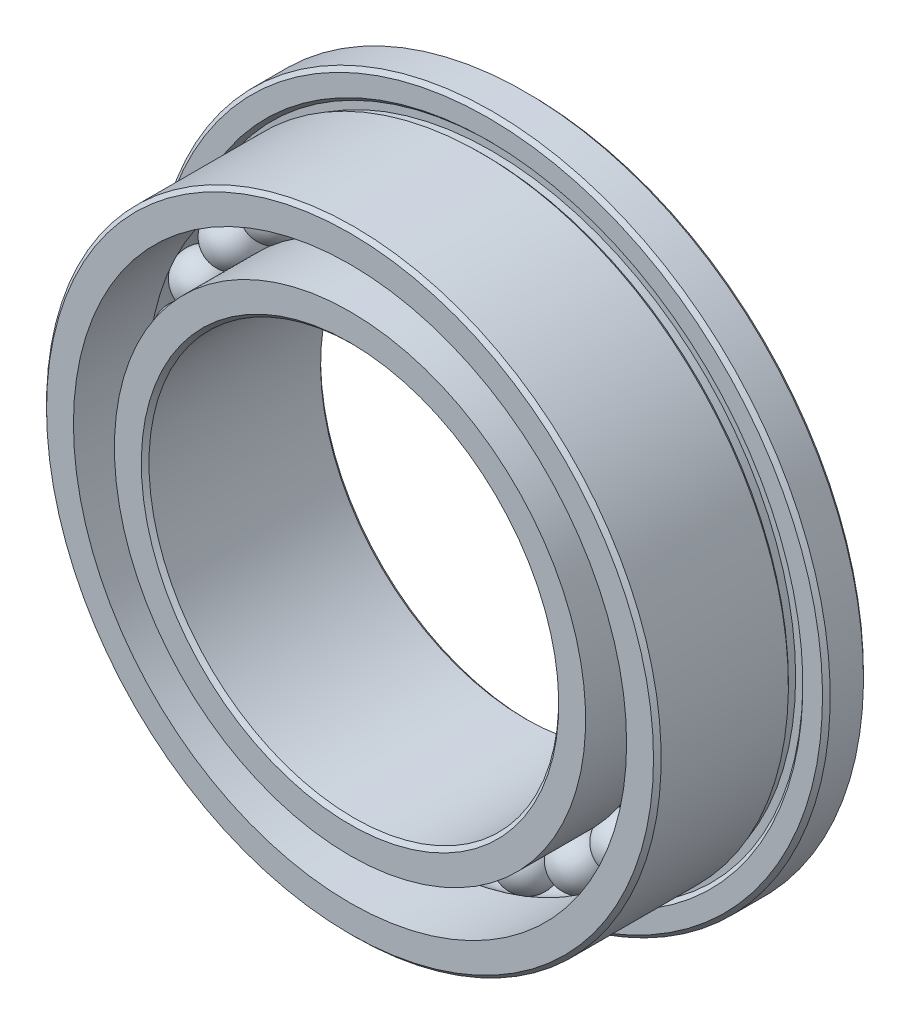
from build123d import *

# Parameters (mm, degrees)
FILLET1_SIZE      = 0.075
FILLET2_SIZE      = 0.075
CIRPATTERN3_COUNT = 27


with BuildPart() as part:
    # Sketch2 → Revolve1 (revolve)
    with BuildSketch(Plane(origin=(0, 0, 0), x_dir=(0, 0, -1), z_dir=(1, 0, 0)), mode=Mode.PRIVATE) as revolve1_sk:
        with BuildLine():
            Line((1.75, 6.6), (0.95, 6.6))
            Line((0.95, 6.6), (0.95, 6.141421356))
            Line((0.95, 6.141421356), (1.020710678, 6.070710678))
            Line((1.020710678, 6.070710678), (1.020710678, 5.929289322))
            Line((1.020710678, 5.929289322), (0.879289322, 5.929289322))
            Line((0.879289322, 5.929289322), (0.808578644, 6))
            Line((0.808578644, 6), (-1.75, 6))
            Line((-1.75, 6), (-1.75, 5.4))
            Line((-1.75, 5.4), (-0.3, 5.4))
            ThreePointArc((-0.3, 5.4), (0, 5.5), (0.3, 5.4))
            Line((0.3, 5.4), (1.75, 5.4))
            Line((1.75, 5.4), (1.75, 6.6))
        make_face()
        with BuildLine():
            Line((1.75, 4), (-1.75, 4))
            Line((-1.75, 4), (-1.75, 4.6))
            Line((-1.75, 4.6), (-0.3, 4.6))
            ThreePointArc((-0.3, 4.6), (0, 4.5), (0.3, 4.6))
            Line((0.3, 4.6), (1.75, 4.6))
            Line((1.75, 4.6), (1.75, 4))
        make_face()
    revolve(revolve1_sk.sketch.rotate(Axis((0, 0, 0), (0, 0, -1)), 180), axis=Axis((0, 0, 0), (0, 0, -1)))

    # Fillet1
    fillet1_edges = [part.edges().sort_by_distance(p)[0] for p in [
        (0, 6, 1.75),
        (0, 6.6, -1.75),
        (0, 6.6, -0.95),
    ]]
    chamfer(fillet1_edges, length=FILLET1_SIZE)

    # Fillet2
    fillet2_edges = [part.edges().sort_by_distance(p)[0] for p in [
        (0, 4, -1.75),
        (0, 4, 1.75),
    ]]
    chamfer(fillet2_edges, length=FILLET2_SIZE)


with BuildPart() as body_2:
    # Sketch7 → Revolve3 (revolve)
    with BuildSketch(Plane.XY):
        with BuildLine():
            Line((0, 5.5), (0, 4.5))
            ThreePointArc((0, 4.5), (-0.5, 5), (0, 5.5))
        make_face()
    revolve(axis=Axis((0, 5.5, 0), (0, -1, 0)))


with BuildPart() as cirpattern3_1:
    # CirPattern3: pattern copy
    add(body_2.part.rotate(Axis((0, 0, 0), (0, 0, 1)), 1 * 360 / CIRPATTERN3_COUNT))


with BuildPart() as cirpattern3_2:
    # CirPattern3: pattern copy
    add(body_2.part.rotate(Axis((0, 0, 0), (0, 0, 1)), 2 * 360 / CIRPATTERN3_COUNT))


with BuildPart() as cirpattern3_3:
    # CirPattern3: pattern copy
    add(body_2.part.rotate(Axis((0, 0, 0), (0, 0, 1)), 3 * 360 / CIRPATTERN3_COUNT))


with BuildPart() as cirpattern3_4:
    # CirPattern3: pattern copy
    add(body_2.part.rotate(Axis((0, 0, 0), (0, 0, 1)), 4 * 360 / CIRPATTERN3_COUNT))


with BuildPart() as cirpattern3_5:
    # CirPattern3: pattern copy
    add(body_2.part.rotate(Axis((0, 0, 0), (0, 0, 1)), 5 * 360 / CIRPATTERN3_COUNT))


with BuildPart() as cirpattern3_6:
    # CirPattern3: pattern copy
    add(body_2.part.rotate(Axis((0, 0, 0), (0, 0, 1)), 6 * 360 / CIRPATTERN3_COUNT))


with BuildPart() as cirpattern3_7:
    # CirPattern3: pattern copy
    add(body_2.part.rotate(Axis((0, 0, 0), (0, 0, 1)), 7 * 360 / CIRPATTERN3_COUNT))


with BuildPart() as cirpattern3_8:
    # CirPattern3: pattern copy
    add(body_2.part.rotate(Axis((0, 0, 0), (0, 0, 1)), 8 * 360 / CIRPATTERN3_COUNT))


with BuildPart() as cirpattern3_9:
    # CirPattern3: pattern copy
    add(body_2.part.rotate(Axis((0, 0, 0), (0, 0, 1)), 9 * 360 / CIRPATTERN3_COUNT))


with BuildPart() as cirpattern3_10:
    # CirPattern3: pattern copy
    add(body_2.part.rotate(Axis((0, 0, 0), (0, 0, 1)), 10 * 360 / CIRPATTERN3_COUNT))


with BuildPart() as cirpattern3_11:
    # CirPattern3: pattern copy
    add(body_2.part.rotate(Axis((0, 0, 0), (0, 0, 1)), 11 * 360 / CIRPATTERN3_COUNT))


with BuildPart() as cirpattern3_12:
    # CirPattern3: pattern copy
    add(body_2.part.rotate(Axis((0, 0, 0), (0, 0, 1)), 12 * 360 / CIRPATTERN3_COUNT))


with BuildPart() as cirpattern3_13:
    # CirPattern3: pattern copy
    add(body_2.part.rotate(Axis((0, 0, 0), (0, 0, 1)), 13 * 360 / CIRPATTERN3_COUNT))


with BuildPart() as cirpattern3_14:
    # CirPattern3: pattern copy
    add(body_2.part.rotate(Axis((0, 0, 0), (0, 0, 1)), 14 * 360 / CIRPATTERN3_COUNT))


with BuildPart() as cirpattern3_15:
    # CirPattern3: pattern copy
    add(body_2.part.rotate(Axis((0, 0, 0), (0, 0, 1)), 15 * 360 / CIRPATTERN3_COUNT))


with BuildPart() as cirpattern3_16:
    # CirPattern3: pattern copy
    add(body_2.part.rotate(Axis((0, 0, 0), (0, 0, 1)), 16 * 360 / CIRPATTERN3_COUNT))


with BuildPart() as cirpattern3_17:
    # CirPattern3: pattern copy
    add(body_2.part.rotate(Axis((0, 0, 0), (0, 0, 1)), 17 * 360 / CIRPATTERN3_COUNT))


with BuildPart() as cirpattern3_18:
    # CirPattern3: pattern copy
    add(body_2.part.rotate(Axis((0, 0, 0), (0, 0, 1)), 18 * 360 / CIRPATTERN3_COUNT))


with BuildPart() as cirpattern3_19:
    # CirPattern3: pattern copy
    add(body_2.part.rotate(Axis((0, 0, 0), (0, 0, 1)), 19 * 360 / CIRPATTERN3_COUNT))


with BuildPart() as cirpattern3_20:
    # CirPattern3: pattern copy
    add(body_2.part.rotate(Axis((0, 0, 0), (0, 0, 1)), 20 * 360 / CIRPATTERN3_COUNT))


with BuildPart() as cirpattern3_21:
    # CirPattern3: pattern copy
    add(body_2.part.rotate(Axis((0, 0, 0), (0, 0, 1)), 21 * 360 / CIRPATTERN3_COUNT))


with BuildPart() as cirpattern3_22:
    # CirPattern3: pattern copy
    add(body_2.part.rotate(Axis((0, 0, 0), (0, 0, 1)), 22 * 360 / CIRPATTERN3_COUNT))


with BuildPart() as cirpattern3_23:
    # CirPattern3: pattern copy
    add(body_2.part.rotate(Axis((0, 0, 0), (0, 0, 1)), 23 * 360 / CIRPATTERN3_COUNT))


with BuildPart() as cirpattern3_24:
    # CirPattern3: pattern copy
    add(body_2.part.rotate(Axis((0, 0, 0), (0, 0, 1)), 24 * 360 / CIRPATTERN3_COUNT))


with BuildPart() as cirpattern3_25:
    # CirPattern3: pattern copy
    add(body_2.part.rotate(Axis((0, 0, 0), (0, 0, 1)), 25 * 360 / CIRPATTERN3_COUNT))


with BuildPart() as cirpattern3_26:
    # CirPattern3: pattern copy
    add(body_2.part.rotate(Axis((0, 0, 0), (0, 0, 1)), 26 * 360 / CIRPATTERN3_COUNT))


solid = Compound([part.part, body_2.part, cirpattern3_1.part, cirpattern3_2.part, cirpattern3_3.part, cirpattern3_4.part, cirpattern3_5.part, cirpattern3_6.part, cirpattern3_7.part, cirpattern3_8.part, cirpattern3_9.part, cirpattern3_10.part, cirpattern3_11.part, cirpattern3_12.part, cirpattern3_13.part, cirpattern3_14.part, cirpattern3_15.part, cirpattern3_16.part, cirpattern3_17.part, cirpattern3_18.part, cirpattern3_19.part, cirpattern3_20.part, cirpattern3_21.part, cirpattern3_22.part, cirpattern3_23.part, cirpattern3_24.part, cirpattern3_25.part, cirpattern3_26.part])
